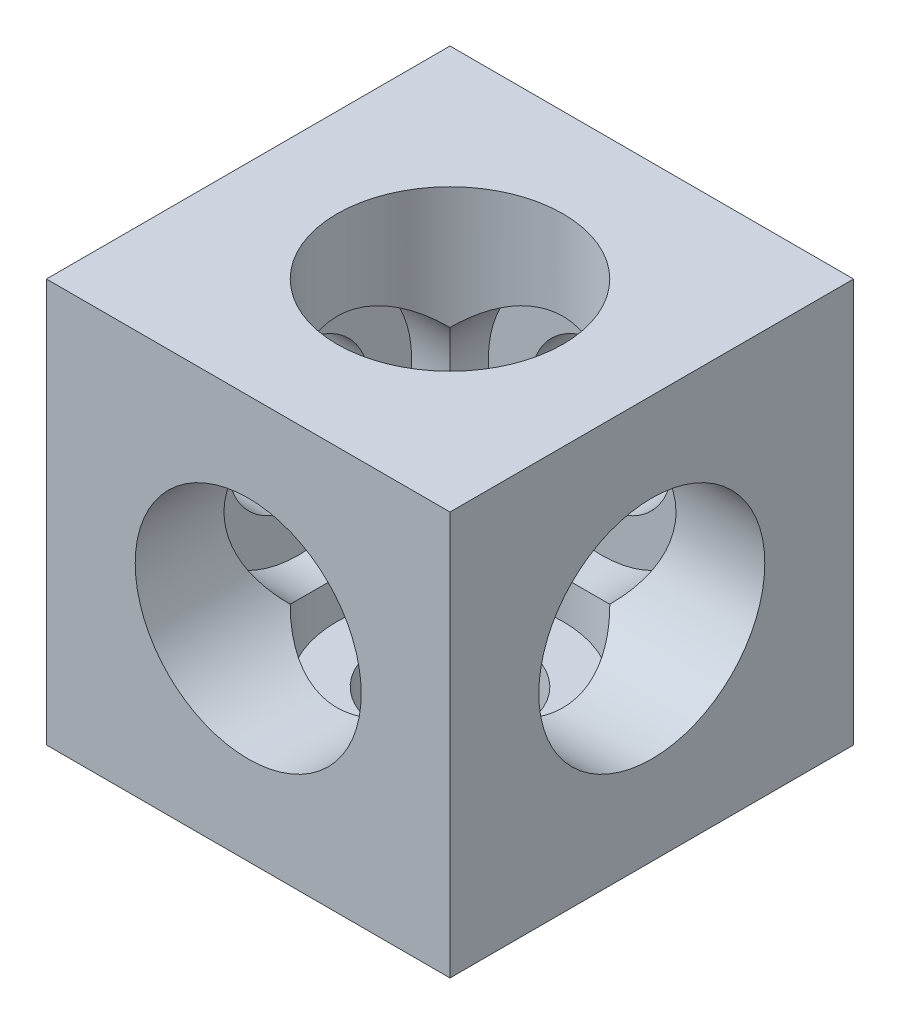
from build123d import *

# Parameters (mm, degrees)
SKETCH1_W           = 20
SKETCH1_H           = 20
BOSS_EXTRUDE1_DEPTH = 10
SKETCH2_R           = 3.5
CUT_EXTRUDE1_DEPTH  = 25.494897428
SKETCH3_R           = 3.5
CUT_EXTRUDE2_DEPTH  = 25.494897428
SKETCH4_R           = 3.5
CUT_EXTRUDE3_DEPTH  = 25.494897428
SKETCH5_R           = 5.6
CUT_EXTRUDE4_DEPTH  = 17.5
SKETCH6_R           = 5.6
CUT_EXTRUDE5_DEPTH  = 17.5
SKETCH7_R           = 5.6
CUT_EXTRUDE6_DEPTH  = 17.5


with BuildPart() as part:
    # Sketch1 → Boss-Extrude1 (new, symmetric)
    with BuildSketch(Plane.XY):
        Rectangle(SKETCH1_W, SKETCH1_H)
    extrude(amount=BOSS_EXTRUDE1_DEPTH, both=True)

    # Sketch2 → Cut-Extrude1 (cut, through all)
    with BuildSketch(Plane(origin=(0, 10, 0), x_dir=(1, 0, 0), z_dir=(0, 1, 0))):
        with Locations(Location((0, 0, 0), (0, 0, 180))):
            Circle(SKETCH2_R)
    extrude(amount=-CUT_EXTRUDE1_DEPTH, mode=Mode.SUBTRACT)

    # Sketch3 → Cut-Extrude2 (cut, through all)
    with BuildSketch(Plane.XY.offset(10)):
        Circle(SKETCH3_R)
    extrude(amount=-CUT_EXTRUDE2_DEPTH, mode=Mode.SUBTRACT)

    # Sketch4 → Cut-Extrude3 (cut, through all)
    with BuildSketch(Plane(origin=(10, 0, 0), x_dir=(0, 0, -1), z_dir=(1, 0, 0))):
        Circle(SKETCH4_R)
    extrude(amount=-CUT_EXTRUDE3_DEPTH, mode=Mode.SUBTRACT)

    # Sketch5 → Cut-Extrude4 (cut)
    with BuildSketch(Plane(origin=(0, 10, 0), x_dir=(1, 0, 0), z_dir=(0, 1, 0))):
        with Locations(Location((0, 0, 0), (0, 0, 180))):
            Circle(SKETCH5_R)
    extrude(amount=-CUT_EXTRUDE4_DEPTH, mode=Mode.SUBTRACT)

    # Sketch6 → Cut-Extrude5 (cut)
    with BuildSketch(Plane.XY.offset(10)):
        Circle(SKETCH6_R)
    extrude(amount=-CUT_EXTRUDE5_DEPTH, mode=Mode.SUBTRACT)

    # Sketch7 → Cut-Extrude6 (cut)
    with BuildSketch(Plane(origin=(10, 0, 0), x_dir=(0, 0, -1), z_dir=(1, 0, 0))):
        Circle(SKETCH7_R)
    extrude(amount=-CUT_EXTRUDE6_DEPTH, mode=Mode.SUBTRACT)


solid = part.part
